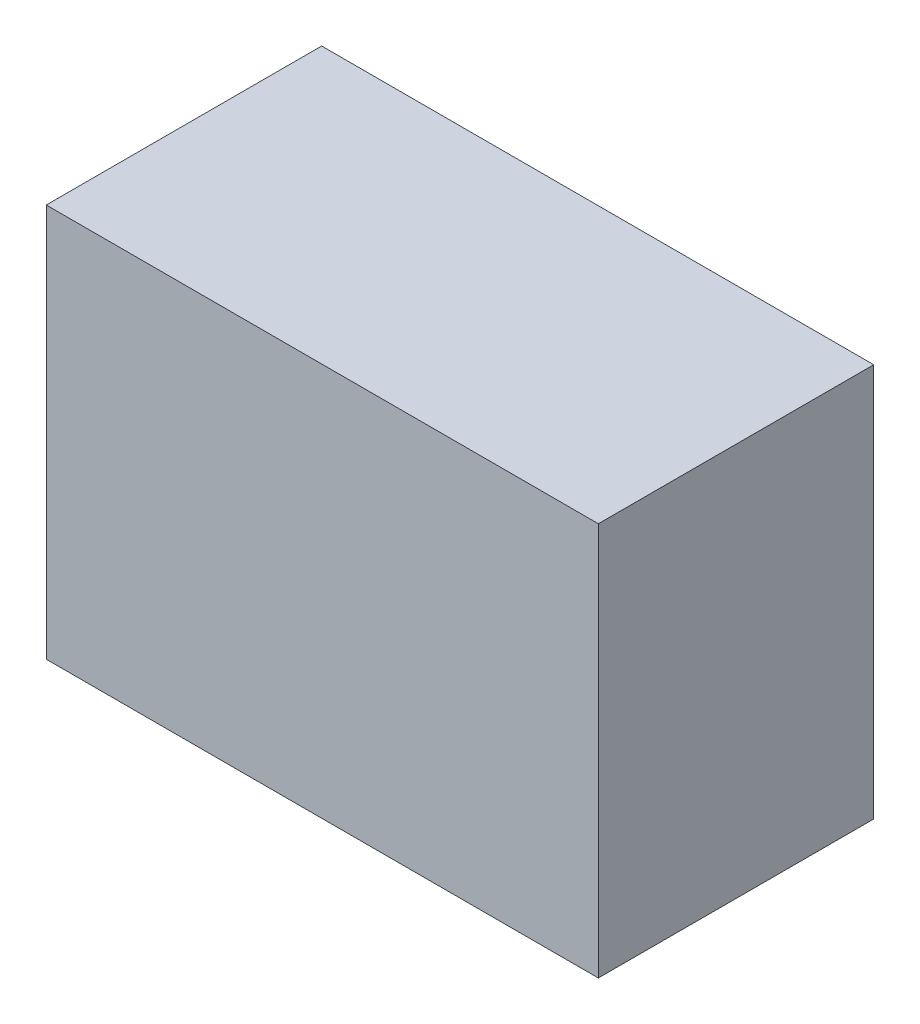
from build123d import *

# Parameters (mm, degrees)
SKETCH1_W           = 16.84
SKETCH1_H           = 12
BOSS_EXTRUDE1_DEPTH = 8.4
CUT_EXTRUDE1_DEPTH  = 8


with BuildPart() as part:
    # Sketch1 → Boss-Extrude1 (new body)
    with BuildSketch(Plane.XY):
        with Locations((0, -4.25)):
            Rectangle(SKETCH1_W, SKETCH1_H)
    extrude(amount=BOSS_EXTRUDE1_DEPTH)

    # Sketch2 → Cut-Extrude1 (cut)
    with BuildSketch(Plane.XZ.offset(10.25)):
        with BuildLine():
            Line((7.42, 6.9), (-7.42, 6.9))
            Line((-7.42, 6.9), (-7.42, 1.7))
            Line((-7.42, 1.7), (-6.82, 1.7))
            ThreePointArc((-6.82, 1.7), (-4.546666667, 0.7), (-2.273333333, 1.7))
            ThreePointArc((-2.273333333, 1.7), (0, 0.7), (2.273333333, 1.7))
            ThreePointArc((2.273333333, 1.7), (4.546666667, 0.7), (6.82, 1.7))
            Line((6.82, 1.7), (7.42, 1.7))
            Line((7.42, 1.7), (7.42, 6.9))
        make_face()
    extrude(amount=-CUT_EXTRUDE1_DEPTH, mode=Mode.SUBTRACT)


solid = part.part
